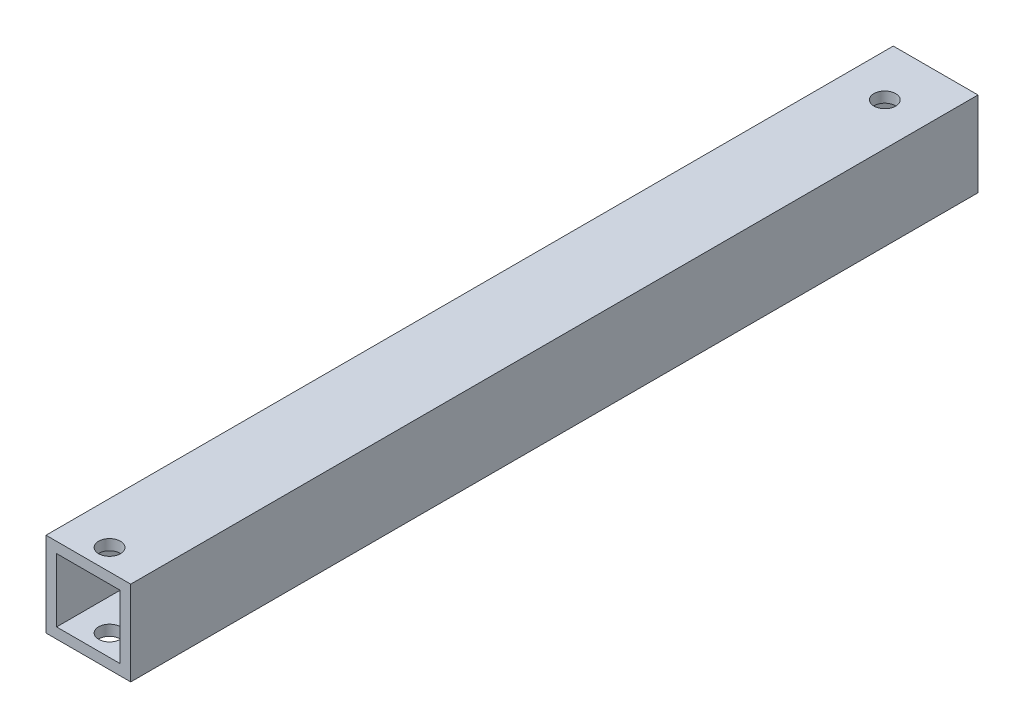
from build123d import *

# Parameters (mm, degrees)
SKETCH2_W           = 25.4
SKETCH2_H           = 25.4
BOSS_EXTRUDE1_DEPTH = 254
SKETCH4_W           = 19.05
SKETCH4_H           = 19.05
CUT_EXTRUDE1_DEPTH  = 255.634208228
SKETCH5_R           = 3.2639
CUT_EXTRUDE2_DEPTH  = 304.8
SKETCH6_R           = 3.2639
CUT_EXTRUDE3_DEPTH  = 256.582569828


with BuildPart() as part:
    # Sketch2 → Boss-Extrude1 (new body)
    with BuildSketch(Plane.XY):
        Rectangle(SKETCH2_W, SKETCH2_H)
    extrude(amount=BOSS_EXTRUDE1_DEPTH)

    # Sketch4 → Cut-Extrude1 (cut, through all)
    with BuildSketch(Plane.XY):
        Rectangle(SKETCH4_W, SKETCH4_H)
    extrude(amount=CUT_EXTRUDE1_DEPTH, mode=Mode.SUBTRACT)

    # Sketch5 → Cut-Extrude2 (cut)
    with BuildSketch(Plane(origin=(0, 12.7, 0), x_dir=(1, 0, 0), z_dir=(0, 1, 0))):
        with Locations(Location((0, -15.24, 0), (0, 0, 270))):
            Circle(SKETCH5_R)
    extrude(amount=-CUT_EXTRUDE2_DEPTH, mode=Mode.SUBTRACT)

    # Sketch6 → Cut-Extrude3 (cut, through all)
    with BuildSketch(Plane(origin=(0, 12.7, 0), x_dir=(1, 0, 0), z_dir=(0, 1, 0))):
        with Locations(Location((0, -247.65, 0), (0, 0, 270))):
            Circle(SKETCH6_R)
    extrude(amount=-CUT_EXTRUDE3_DEPTH, mode=Mode.SUBTRACT)


solid = part.part
